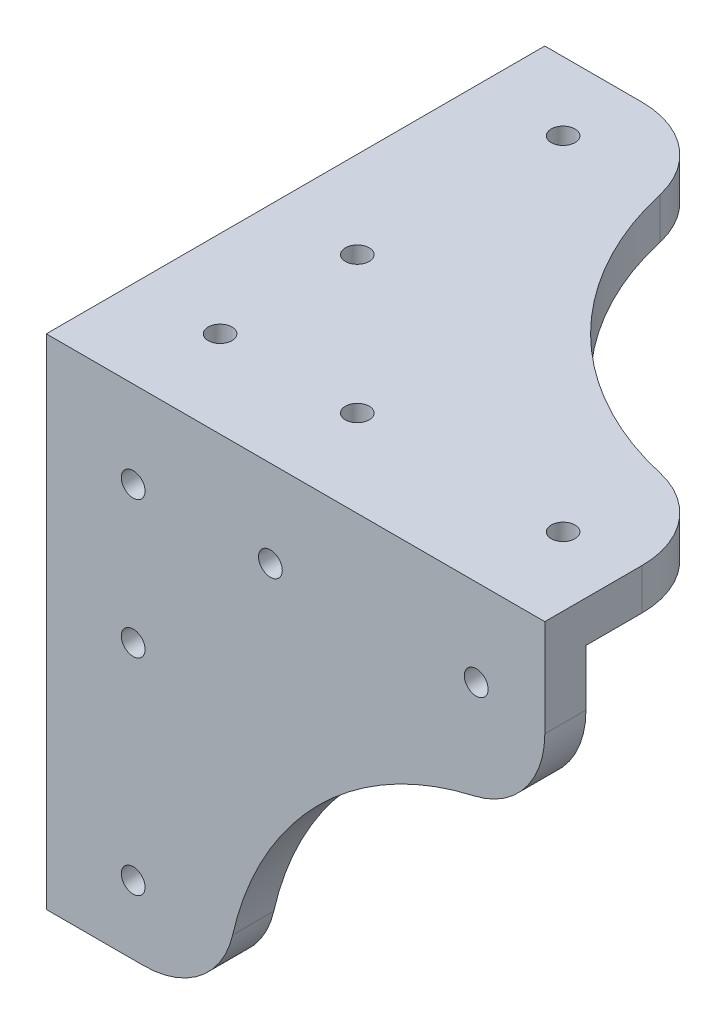
from build123d import *

# Parameters (mm, degrees)
BOSS_EXTRUDE1_DEPTH = 9
BOSS_EXTRUDE2_DEPTH = 9
BOSS_EXTRUDE3_DEPTH = 9
FILLET1_R           = 20
SKETCH4_R           = 2.6
CUT_EXTRUDE1_DEPTH  = 184.744387669
SKETCH5_R           = 2.6
CUT_EXTRUDE2_DEPTH  = 184.744387669
SKETCH6_R           = 2.6
CUT_EXTRUDE3_DEPTH  = 189.793538025


with BuildPart() as part:
    # Sketch1 → Boss-Extrude1 (new body)
    with BuildSketch(Plane.XY):
        with BuildLine():
            Line((0, 0), (109, 0))
            Line((109, 0), (109, -39))
            ThreePointArc((109, -39), (59.502525317, -59.502525317), (39, -109))
            Line((39, -109), (0, -109))
            Line((0, -109), (0, 0))
        make_face()
    extrude(amount=BOSS_EXTRUDE1_DEPTH)

    # Sketch2 → Boss-Extrude2 (add)
    with BuildSketch(Plane(origin=(0, 0, 0), x_dir=(1, 0, 0), z_dir=(0, 1, 0))):
        with BuildLine():
            Line((0, 0), (0, 100))
            Line((0, 100), (39, 100))
            ThreePointArc((39, 100), (59.502525317, 50.502525317), (109, 30))
            Line((109, 30), (109, 0))
            Line((109, 0), (0, 0))
        make_face()
    extrude(amount=-BOSS_EXTRUDE2_DEPTH)

    # Sketch3 → Boss-Extrude3 (add)
    with BuildSketch(Plane.ZY):
        with BuildLine():
            Line((-30, -109), (0, -109))
            Line((0, -109), (0, -9))
            Line((0, -9), (-100, -9))
            Line((-100, -9), (-100, -39))
            ThreePointArc((-100, -39), (-50.502525317, -59.502525317), (-30, -109))
        make_face()
    extrude(amount=-BOSS_EXTRUDE3_DEPTH)

    # Fillet1
    fillet1_edges = [part.edges().sort_by_distance(p)[0] for p in [
        (4.5, -109, -30),
        (4.5, -39, -100),
        (39, -4.5, -100),
        (39, -109, 4.5),
        (109, -39, 4.5),
        (109, -4.5, -30),
    ]]
    fillet(fillet1_edges, radius=FILLET1_R)

    # Sketch4 → Cut-Extrude1 (cut, through all)
    with BuildSketch(Plane(origin=(0, 0, 0), x_dir=(1, 0, 0), z_dir=(0, 1, 0))):
        with Locations(Location((19, 85, 0), (0, 0, 270))):
            Circle(SKETCH4_R)
        with Locations(Location((19, 10, 0), (0, 0, 270))):
            Circle(SKETCH4_R)
        with Locations(Location((94, 10, 0), (0, 0, 270))):
            Circle(SKETCH4_R)
        with Locations(Location((49, 10, 0), (0, 0, 270))):
            Circle(SKETCH4_R)
        with Locations(Location((19, 40, 0), (0, 0, 270))):
            Circle(SKETCH4_R)
    extrude(amount=-CUT_EXTRUDE1_DEPTH, mode=Mode.SUBTRACT)

    # Sketch5 → Cut-Extrude2 (cut, through all)
    with BuildSketch(Plane.ZY):
        with Locations((-85, -19)):
            Circle(SKETCH5_R)
        with Locations((-40, -19)):
            Circle(SKETCH5_R)
        with Locations((-10, -19)):
            Circle(SKETCH5_R)
        with Locations((-10, -49)):
            Circle(SKETCH5_R)
        with Locations((-10, -94)):
            Circle(SKETCH5_R)
    extrude(amount=-CUT_EXTRUDE2_DEPTH, mode=Mode.SUBTRACT)

    # Sketch6 → Cut-Extrude3 (cut, through all)
    with BuildSketch(Plane.XY.offset(9)):
        with Locations((19, -19)):
            Circle(SKETCH6_R)
        with Locations((49, -19)):
            Circle(SKETCH6_R)
        with Locations((94, -19)):
            Circle(SKETCH6_R)
        with Locations((19, -49)):
            Circle(SKETCH6_R)
        with Locations((19, -94)):
            Circle(SKETCH6_R)
    extrude(amount=-CUT_EXTRUDE3_DEPTH, mode=Mode.SUBTRACT)


solid = part.part
